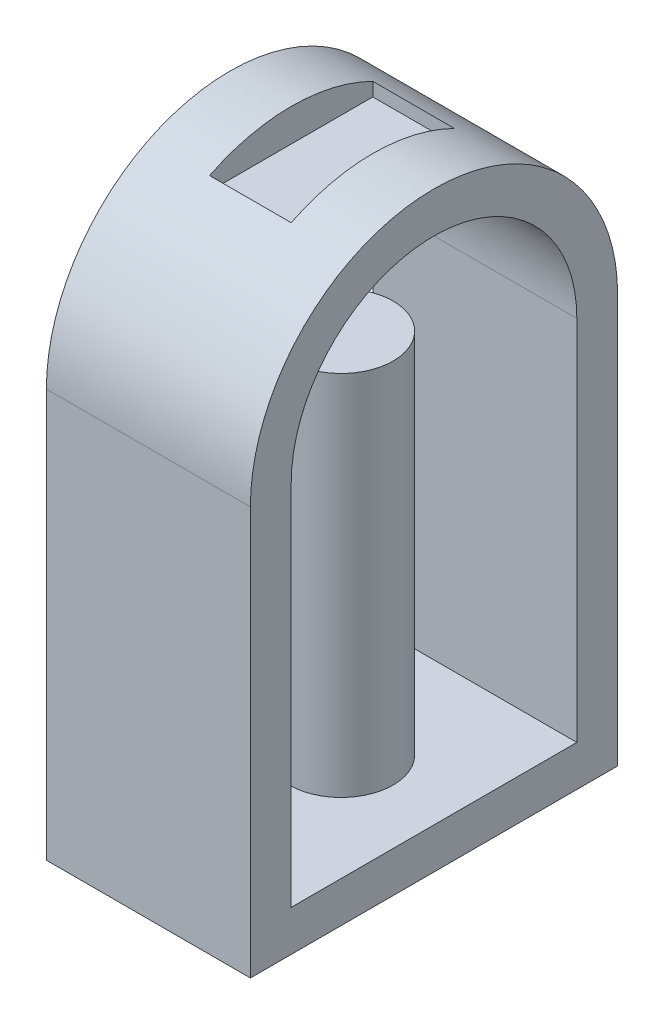
from build123d import *

# Parameters (mm, degrees)
BOSS_EXTRUDE1_DEPTH = 127
SKETCH2_W           = 50.8
SKETCH2_H           = 101.6
CUT_EXTRUDE1_DEPTH  = 20.32
BOSS_EXTRUDE2_REACH = 351.192
SKETCH3_R           = 32.362244647


with BuildPart() as part:
    # Sketch1 → Boss-Extrude1 (new body)
    with BuildSketch(Plane(origin=(0, 0, 0), x_dir=(0, 0, -1), z_dir=(1, 0, 0))):
        with BuildLine():
            Line((-25.4, -25.4), (-25.4, 228.6))
            ThreePointArc((-25.4, 228.6), (88.9, 342.9), (203.2, 228.6))
            Line((203.2, 228.6), (203.2, -25.4))
            Line((203.2, -25.4), (-25.4, -25.4))
        make_face()
        with BuildLine():
            Line((0, 0), (177.8, 0))
            Line((177.8, 0), (177.8, 228.6))
            ThreePointArc((177.8, 228.6), (88.9, 317.5), (0, 228.6))
            Line((0, 228.6), (0, 0))
        make_face(mode=Mode.SUBTRACT)
    extrude(amount=BOSS_EXTRUDE1_DEPTH)

    # Sketch2 → Cut-Extrude1 (cut)
    with BuildSketch(Plane(origin=(0, 342.9, 0), x_dir=(1, 0, 0), z_dir=(0, 1, 0))):
        with Locations((63.5, 88.9)):
            Rectangle(SKETCH2_W, SKETCH2_H)
    extrude(amount=-CUT_EXTRUDE1_DEPTH, mode=Mode.SUBTRACT)

    # Sketch3 → Boss-Extrude2 (add, up to next)
    with BuildSketch(Plane(origin=(0, 228.6, 0), x_dir=(1, 0, 0), z_dir=(0, 1, 0)), mode=Mode.PRIVATE) as boss_extrude2_sk1:
        with Locations(Location((60.471295446, 97.62979548, 0), (0, 0, 270))):
            Circle(SKETCH3_R)
    boss_extrude2_tool1 = extrude(boss_extrude2_sk1.sketch, amount=-BOSS_EXTRUDE2_REACH, mode=Mode.PRIVATE) - part.part
    add(boss_extrude2_tool1.solids().sort_by_distance((60.471295, 228.6, -97.629795))[0])


solid = part.part
